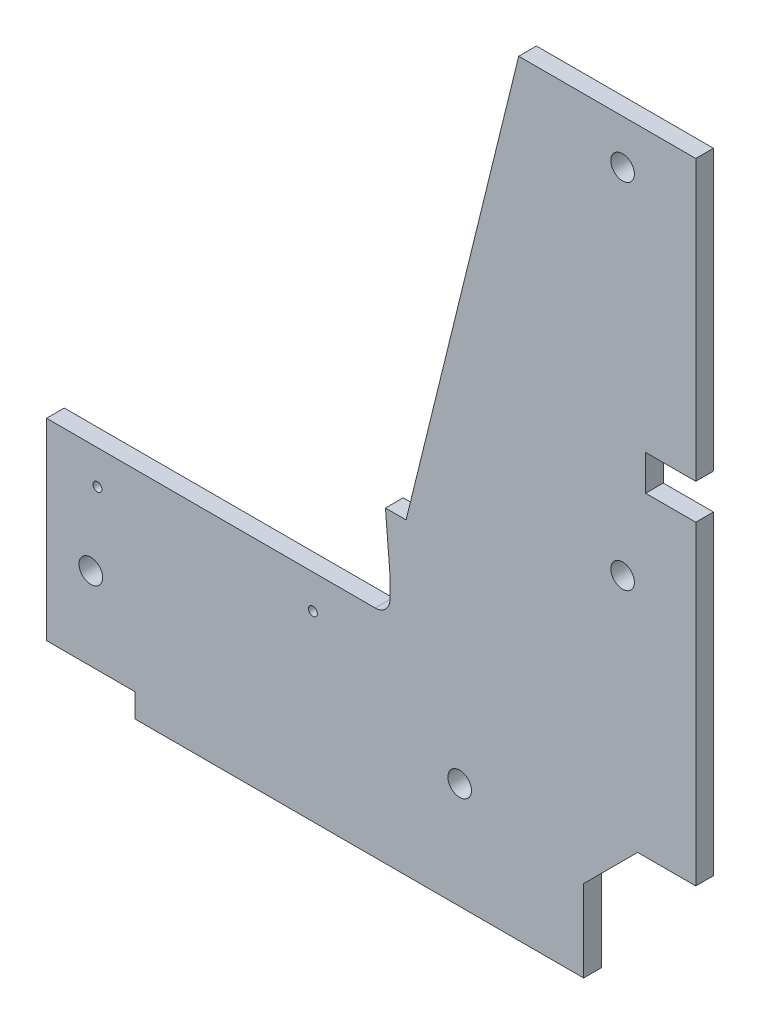
from build123d import *

# Parameters (mm, degrees)
BOSS_EXTRUDE2_DEPTH     = 6
SKETCH2_R               = 4
SKETCH2_W               = 30
SKETCH2_H               = 8.3
CUT_EXTRUDE1_DEPTH      = 341.487943986
CROQUIS1_W              = 103.610606389
CROQUIS1_H              = 1.56
SALIENTE_EXTRUIR2_DEPTH = 6
SALIENTE_EXTRUIR3_DEPTH = 6
SALIENTE_EXTRUIR4_START = -6
SALIENTE_EXTRUIR4_DEPTH = 6
SALIENTE_EXTRUIR5_DEPTH = 6
SALIENTE_EXTRUIR6_DEPTH = 6
CROQUIS7_W              = 103.610606389
CROQUIS7_H              = 0.56
SALIENTE_EXTRUIR7_DEPTH = 6
SALIENTE_EXTRUIR8_DEPTH = 6
SKETCH3_R               = 1.5
CUT_EXTRUDE2_DEPTH      = 341.487943986
CUT_EXTRUDE3_DEPTH      = 341.487943986
CROQUIS9_W              = 152
CROQUIS9_H              = 0.3
CORTAR_EXTRUIR1_DEPTH   = 10
CORTAR_EXTRUIR2_DEPTH   = 6
CROQUIS12_R             = 4
CORTAR_EXTRUIR3_DEPTH   = 6
SALIENTE_EXTRUIR9_DEPTH = 6
CROQUIS14_W             = 17
CROQUIS14_H             = 12
CORTAR_EXTRUIR4_DEPTH   = 10


with BuildPart() as part:
    # Sketch1 → Boss-Extrude2 (new body)
    with BuildSketch(Plane.XY):
        with BuildLine():
            Line((0, 0), (-220, 0))
            Line((-220, 0), (-220, 71.45))
            Line((-220, 71.45), (-116.389393611, 71.45))
            ThreePointArc((-116.389393611, 71.45), (-107.149394721, 74.662079518), (-101.894274329, 82.913063942))
            Line((-101.894274329, 82.913063942), (-60, 259.8))
            Line((-60, 259.8), (0, 259.8))
            Line((0, 259.8), (0, 0))
        make_face()
    extrude(amount=BOSS_EXTRUDE2_DEPTH)

    # Sketch2 → Cut-Extrude1 (cut, through all)
    with BuildSketch(Plane.XY.offset(6)):
        with Locations((-205, 36.3)):
            Circle(SKETCH2_R)
        with Locations((-24.8, 244.8)):
            Circle(SKETCH2_R)
        with Locations((-24.8, 125)):
            Circle(SKETCH2_R)
        with Locations((-80, 43.8)):
            Circle(SKETCH2_R)
        with Locations((-205, 4.15)):
            Rectangle(SKETCH2_W, SKETCH2_H)
        Polygon((-38, 0), (-38, 19), (-10.7, 46.3), (0, 46.3), (0, 0), align=None)
    extrude(amount=-CUT_EXTRUDE1_DEPTH, mode=Mode.SUBTRACT)

    # Croquis1 → Saliente-Extruir2 (add)
    with BuildSketch(Plane.XY.offset(6)):
        with Locations((-168.194696806, 72.23)):
            Rectangle(CROQUIS1_W, CROQUIS1_H)
    extrude(amount=-SALIENTE_EXTRUIR2_DEPTH)

    # Croquis3 → Saliente-Extruir3 (add)
    with BuildSketch(Plane.XY.offset(6)):
        Polygon((-101.894274329, 82.913063942), (-103.412279578, 83.272591501), (-60, 259.8), align=None)
    extrude(amount=-SALIENTE_EXTRUIR3_DEPTH)

    # Croquis4 → Saliente-Extruir4 (add)
    with BuildSketch(Plane.XY.offset(6).offset(SALIENTE_EXTRUIR4_START)):
        with BuildLine():
            Line((-103.412279578, 83.272591501), (-101.894274329, 82.913063942))
            ThreePointArc((-101.894274329, 82.913063942), (-107.149394721, 74.662079518), (-116.389393611, 71.45))
            Line((-116.389393611, 71.45), (-116.389393611, 73.01))
            ThreePointArc((-116.389393611, 73.01), (-108.117056079, 75.88569363), (-103.412279578, 83.272591501))
        make_face()
    extrude(amount=SALIENTE_EXTRUIR4_DEPTH)

    # Croquis5 → Saliente-Extruir5 (add)
    with BuildSketch(Plane.XY.offset(6)):
        Polygon((-105, 102.74), (-55, 102.74), (-103.412279578, 83.272591501), align=None)
    extrude(amount=-SALIENTE_EXTRUIR5_DEPTH)

    # Croquis6 → Saliente-Extruir6 (add)
    with BuildSketch(Plane.XY.offset(6)):
        Polygon((-98.157526679, 104.64), (-105.154959958, 104.64), (-105, 102.74), (-98.624781775, 102.74), align=None)
    extrude(amount=-SALIENTE_EXTRUIR6_DEPTH)

    # Croquis7 → Saliente-Extruir7 (add)
    with BuildSketch(Plane.XY.offset(6)):
        with Locations((-168.194696806, 73.29)):
            Rectangle(CROQUIS7_W, CROQUIS7_H)
    extrude(amount=-SALIENTE_EXTRUIR7_DEPTH)

    # Croquis8 → Saliente-Extruir8 (add)
    with BuildSketch(Plane.XY.offset(6)):
        with BuildLine():
            Line((-116.389393611, 73.57), (-117.98880457, 71.652693326))
            Line((-117.98880457, 71.652693326), (-105.380568296, 73.057716723))
            Line((-105.380568296, 73.057716723), (-100.684832206, 83.373546401))
            Line((-100.684832206, 83.373546401), (-103.622774874, 85.853523162))
            ThreePointArc((-103.622774874, 85.853523162), (-107.531184208, 77.13952683), (-116.389393611, 73.57))
        make_face()
    extrude(amount=-SALIENTE_EXTRUIR8_DEPTH)

    # Sketch3 → Cut-Extrude2 (cut, through all)
    with BuildSketch(Plane.XY.offset(6)):
        with Locations((-202.75, 62.07)):
            Circle(SKETCH3_R)
        with Locations((-129.75, 62.07)):
            Circle(SKETCH3_R)
    extrude(amount=-CUT_EXTRUDE2_DEPTH, mode=Mode.SUBTRACT)

    # Sketch4 → Cut-Extrude3 (cut, through all)
    with BuildSketch(Plane.XY.offset(6)):
        with BuildLine():
            Line((-103.622774874, 85.853523162), (-103.622774874, 78.57))
            ThreePointArc((-103.622774874, 78.57), (-105.087240968, 75.034466094), (-108.622774874, 73.57))
            Line((-108.622774874, 73.57), (-116.389393611, 73.57))
            ThreePointArc((-116.389393611, 73.57), (-107.531184208, 77.13952683), (-103.622774874, 85.853523162))
        make_face()
    extrude(amount=-CUT_EXTRUDE3_DEPTH, mode=Mode.SUBTRACT)

    # Croquis9 → Cortar-Extruir1 (cut)
    with BuildSketch(Plane.XY.offset(6)):
        with Locations((-114, 0.15)):
            Rectangle(CROQUIS9_W, CROQUIS9_H)
    extrude(amount=-CORTAR_EXTRUIR1_DEPTH, mode=Mode.SUBTRACT)

    # Croquis11 → Cortar-Extruir2 (cut)
    with BuildSketch(Plane.XY.offset(6)):
        Polygon((-10.7, 46.3), (-19.7, 46.3), (-38, 28), (-38, 19), align=None)
    extrude(amount=-CORTAR_EXTRUIR2_DEPTH, mode=Mode.SUBTRACT)

    # Croquis12 → Cortar-Extruir3 (cut)
    with BuildSketch(Plane.XY.offset(6)):
        with Locations((-80, 36.3)):
            Circle(CROQUIS12_R)
    extrude(amount=-CORTAR_EXTRUIR3_DEPTH, mode=Mode.SUBTRACT)

    # Croquis13 → Saliente-Extruir9 (add)
    with BuildSketch(Plane.XY.offset(6)):
        with BuildLine():
            ThreePointArc((-78.608058909, 40.05), (-76.716117819, 41.516117819), (-76, 43.8))
            ThreePointArc((-76, 43.8), (-82.283882181, 47.083882181), (-81.391941091, 40.05))
            ThreePointArc((-81.391941091, 40.05), (-80, 40.3), (-78.608058909, 40.05))
        make_face()
    extrude(amount=-SALIENTE_EXTRUIR9_DEPTH)

    # Croquis14 → Cortar-Extruir4 (cut)
    with BuildSketch(Plane.XY.offset(6)):
        with Locations((-8.5, 159.05)):
            Rectangle(CROQUIS14_W, CROQUIS14_H)
    extrude(amount=-CORTAR_EXTRUIR4_DEPTH, mode=Mode.SUBTRACT)


solid = part.part
